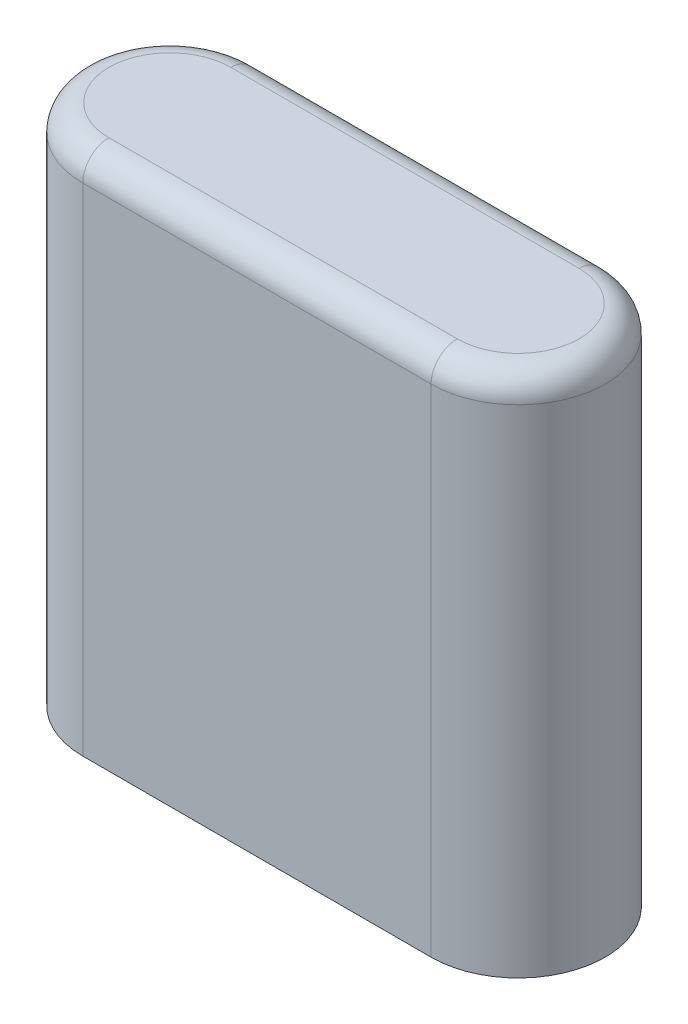
from build123d import *

# Parameters (mm, degrees)
EXTRUDE_1_DEPTH = 30
FILLET_1_R      = 3
SKETCH_2_R      = 3
SKETCH_2_R_2    = 4.5
EXTRUDE_2_DEPTH = 3


with BuildPart() as part:
    # 草图1 → 凸台-拉伸1 (new, symmetric)
    with BuildSketch(Plane(origin=(0, 0, 0), x_dir=(1, 0, 0), z_dir=(0, 1, 0))):
        with BuildLine():
            Line((-20, 10), (20, 10))
            ThreePointArc((20, 10), (30, 0), (20, -10))
            Line((20, -10), (-20, -10))
            ThreePointArc((-20, -10), (-30, 0), (-20, 10))
        make_face()
    extrude(amount=EXTRUDE_1_DEPTH, both=True)

    # 圆角1
    fillet_1_edges = [part.edges().sort_by_distance(p)[0] for p in [
        (30, 30, 0),
        (0, 30, -10),
        (-30, 30, 0),
        (0, 30, 10),
    ]]
    fillet(fillet_1_edges, radius=FILLET_1_R)

    # 草图2 → 凸台-拉伸2 (add)
    # profile 1 of 2: a face of its own
    with BuildSketch(Plane.XZ.offset(30)):
        with Locations(Location((-20, 0, 0), (0, 0, 90))):
            Circle(SKETCH_2_R)
    # profile 2 of 2: a face of its own
    with BuildSketch(Plane.XZ.offset(30)):
        with Locations(Location((20, 0, 0), (0, 0, 90))):
            Circle(SKETCH_2_R_2)
        with Locations(Location((20, 0, 0), (0, 0, 270))):
            Circle(SKETCH_2_R, mode=Mode.SUBTRACT)
    extrude(amount=EXTRUDE_2_DEPTH)


solid = part.part
